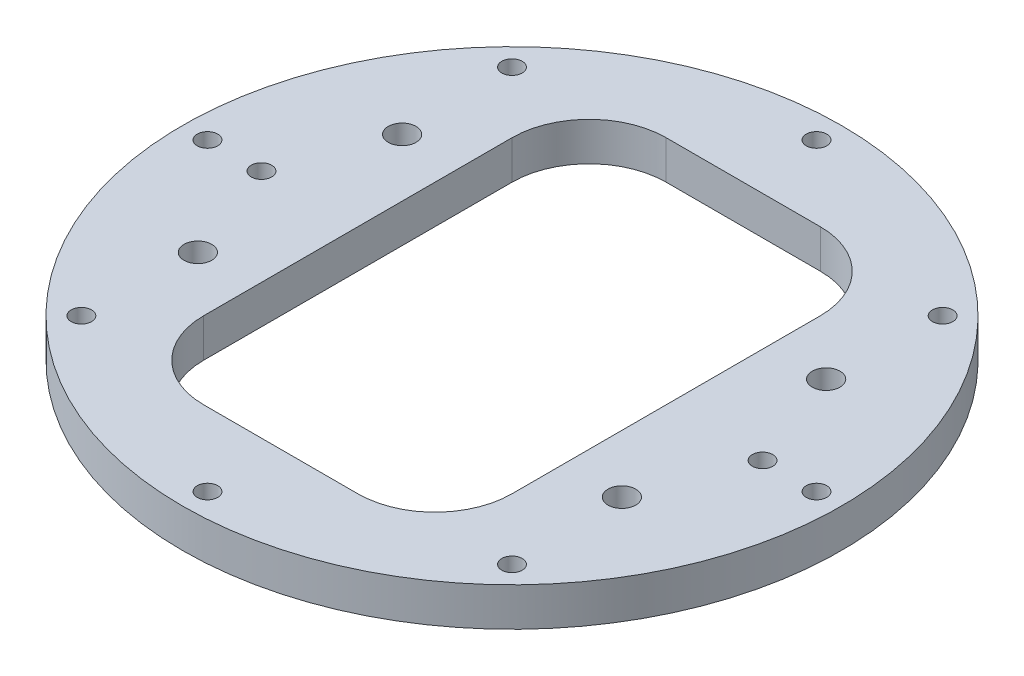
from build123d import *

# Parameters (mm, degrees)
SKETCH_1_R          = 85.5
SKETCH_1_R_2        = 2.65
SKETCH_1_W          = 80
SKETCH_1_H          = 100
EXTRUDE_3_DEPTH     = 10
SKETCH_10_R         = 3.6
SKETCH_10_R_2       = 2.65
CUT_EXTRUDE_2_DEPTH = 10
SKETCH_11_W         = 80
SKETCH_11_H         = 120
CUT_EXTRUDE_3_DEPTH = 10
FILLET_1_R          = 20


with BuildPart() as part:
    # 草图1 → 凸台-拉伸3 (new body)
    with BuildSketch(Plane(origin=(0, 0, 0), x_dir=(1, 0, 0), z_dir=(0, 1, 0))):
        with Locations(Location((0, 0, 0), (0, 0, 270))):
            Circle(SKETCH_1_R)
        with Locations(Location((0, 79, 0), (0, 0, 270))):
            Circle(SKETCH_1_R_2, mode=Mode.SUBTRACT)
        with Locations(Location((55.861435714, 55.861435714, 0), (0, 0, 270))):
            Circle(SKETCH_1_R_2, mode=Mode.SUBTRACT)
        with Locations(Location((79, 0, 0), (0, 0, 270))):
            Circle(SKETCH_1_R_2, mode=Mode.SUBTRACT)
        with Locations(Location((55.861435714, -55.861435714, 0), (0, 0, 270))):
            Circle(SKETCH_1_R_2, mode=Mode.SUBTRACT)
        with Locations(Location((0, -79, 0), (0, 0, 270))):
            Circle(SKETCH_1_R_2, mode=Mode.SUBTRACT)
        with Locations(Location((-55.861435714, -55.861435714, 0), (0, 0, 270))):
            Circle(SKETCH_1_R_2, mode=Mode.SUBTRACT)
        with Locations(Location((-79, 0, 0), (0, 0, 270))):
            Circle(SKETCH_1_R_2, mode=Mode.SUBTRACT)
        with Locations(Location((-55.861435714, 55.861435714, 0), (0, 0, 270))):
            Circle(SKETCH_1_R_2, mode=Mode.SUBTRACT)
        Rectangle(SKETCH_1_W, SKETCH_1_H, mode=Mode.SUBTRACT)
    extrude(amount=EXTRUDE_3_DEPTH)

    # 草图10 → 切除-拉伸2 (cut)
    with BuildSketch(Plane(origin=(0, 10, 0), x_dir=(1, 0, 0), z_dir=(0, 1, 0))):
        with Locations(Location((55, 26.5, 0), (0, 0, 270))):
            Circle(SKETCH_10_R)
        with Locations(Location((65, 0, 0), (0, 0, 270))):
            Circle(SKETCH_10_R_2)
        with Locations(Location((55, -26.5, 0), (0, 0, 270))):
            Circle(SKETCH_10_R)
        with Locations(Location((-55, -26.5, 0), (0, 0, 270))):
            Circle(SKETCH_10_R)
        with Locations(Location((-55, 26.5, 0), (0, 0, 90))):
            Circle(SKETCH_10_R)
        with Locations(Location((-65, 0, 0), (0, 0, 270))):
            Circle(SKETCH_10_R_2)
    extrude(amount=-CUT_EXTRUDE_2_DEPTH, mode=Mode.SUBTRACT)

    # 草图11 → 切除-拉伸3 (cut)
    with BuildSketch(Plane(origin=(0, 10, 0), x_dir=(1, 0, 0), z_dir=(0, 1, 0))):
        Rectangle(SKETCH_11_W, SKETCH_11_H)
    extrude(amount=-CUT_EXTRUDE_3_DEPTH, mode=Mode.SUBTRACT)

    # 圆角1
    fillet_1_edges = [part.edges().sort_by_distance(p)[0] for p in [
        (40, 5, -60),
        (40, 5, 60),
        (-40, 5, 60),
        (-40, 5, -60),
    ]]
    fillet(fillet_1_edges, radius=FILLET_1_R)


solid = part.part
